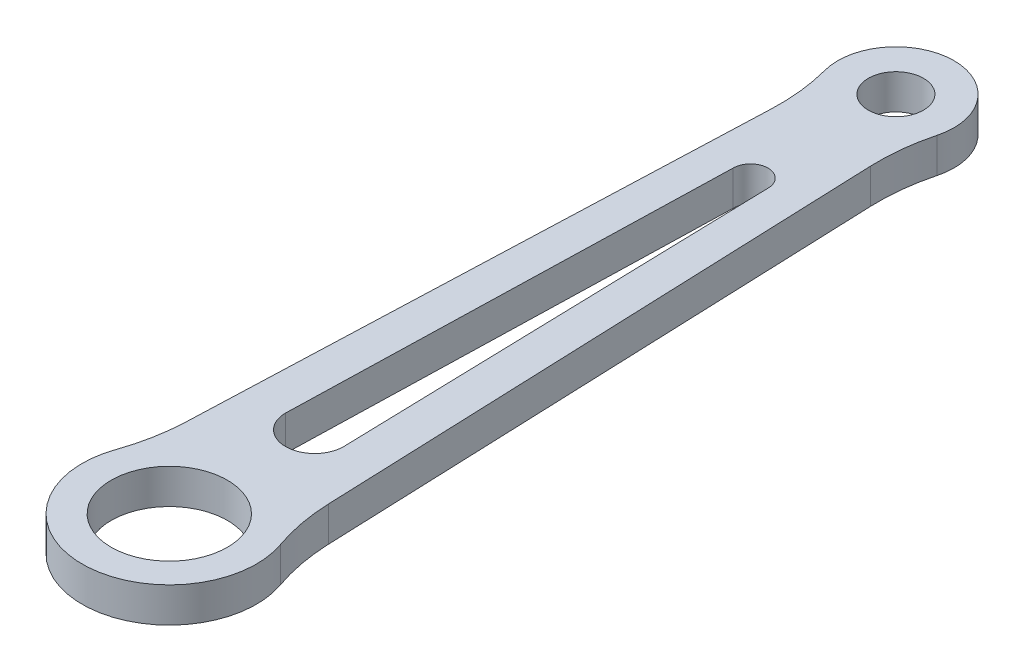
from build123d import *

# Parameters (mm, degrees)
SKETCH_1_R          = 5.05
SKETCH_1_R_2        = 9.5
EXTRUDE_1_DEPTH     = 12
FILLET_1_R          = 3
SKETCH_7_R          = 2.05
CUT_EXTRUDE_4_DEPTH = 277.39464539
EXTRUDE_6_DEPTH     = 12
SKETCH_8_R          = 13
CUT_EXTRUDE_5_DEPTH = 277.39464539
SKETCH_9_R          = 25
SKETCH_9_R_2        = 13
EXTRUDE_4_DEPTH     = 12
SKETCH_10_R         = 1.5
SKETCH_10_R_2       = 21.5
EXTRUDE_5_DEPTH     = 12
SKETCH_13_R         = 1.5
SKETCH_13_R_2       = 19.999997197
SKETCH_13_R_3       = 13
CUT_EXTRUDE_6_DEPTH = 25


with BuildPart() as part:
    # 草图1 → 凸台-拉伸1 (new body)
    with BuildSketch(Plane(origin=(0, 0, 0), x_dir=(1, 0, 0), z_dir=(0, 1, 0))):
        with BuildLine():
            Line((-17.992942616, -0.504), (-24.990198078, 249.3))
            ThreePointArc((-24.990198078, 249.3), (0, 275), (24.990198078, 249.3))
            Line((24.990198078, 249.3), (17.992942616, -0.504))
            ThreePointArc((17.992942616, -0.504), (0, -18), (-17.992942616, -0.504))
        make_face()
        with Locations(Location((0, 0, 0), (0, 0, 270))):
            Circle(SKETCH_1_R, mode=Mode.SUBTRACT)
        with Locations(Location((0, 250, 0), (0, 0, 270))):
            Circle(SKETCH_1_R_2, mode=Mode.SUBTRACT)
        Polygon((-16.444447487, 158.5), (-17.704941698, 203.5), (11.028871219, 137.174942267), align=None, mode=Mode.SUBTRACT)
        Polygon((15.954255294, 141), (18.475243716, 231), (-12, 219.5), align=None, mode=Mode.SUBTRACT)
    extrude(amount=EXTRUDE_1_DEPTH)

    # 圆角1
    fillet_1_edges = [part.edges().sort_by_distance(p)[0] for p in [
        (-16.444447487, 6, -158.5),
        (11.028871219, 6, -137.174942267),
        (-17.704941698, 6, -203.5),
        (18.475243716, 6, -231),
        (-12, 6, -219.5),
        (15.954255294, 6, -141),
    ]]
    fillet(fillet_1_edges, radius=FILLET_1_R)

    # 草图7 → 切除-拉伸4 (cut, through all)
    with BuildSketch(Plane(origin=(0, 12, 0), x_dir=(1, 0, 0), z_dir=(0, 1, 0))):
        with Locations(Location((15, 15, 0), (0, 0, 270))):
            Circle(SKETCH_7_R)
        with Locations(Location((-15, 15, 0), (0, 0, 270))):
            Circle(SKETCH_7_R)
        with Locations((-15, -15)):
            Circle(SKETCH_7_R)
        with Locations((15, -15)):
            Circle(SKETCH_7_R)
    extrude(amount=-CUT_EXTRUDE_4_DEPTH, mode=Mode.SUBTRACT)

    # 草图14 → 凸台-拉伸6 (add)
    with BuildSketch(Plane(origin=(0, 12, 0), x_dir=(1, 0, 0), z_dir=(0, 1, 0))):
        Polygon((-17.958821841, 235.186562879), (21.367198419, 232.917754018), (15.538653821, 131.889647666), (-22.497275836, 156.52002696), align=None)
    extrude(amount=-EXTRUDE_6_DEPTH)

    # 草图8 → 切除-拉伸5 (cut, through all)
    with BuildSketch(Plane(origin=(0, 12, 0), x_dir=(1, 0, 0), z_dir=(0, 1, 0))):
        with Locations(Location((0, 0, 0), (0, 0, 270))):
            Circle(SKETCH_8_R)
    extrude(amount=-CUT_EXTRUDE_5_DEPTH, mode=Mode.SUBTRACT)

    # 草图9 → 凸台-拉伸4 (add)
    with BuildSketch(Plane(origin=(0, 12, 0), x_dir=(1, 0, 0), z_dir=(0, 1, 0))):
        Circle(SKETCH_9_R)
        with Locations(Location((0, 0, 0), (0, 0, 270))):
            Circle(SKETCH_9_R_2, mode=Mode.SUBTRACT)
    extrude(amount=-EXTRUDE_4_DEPTH)

    # 草图10 → 凸台-拉伸5 (add)
    with BuildSketch(Plane(origin=(0, 12, 0), x_dir=(1, 0, 0), z_dir=(0, 1, 0))):
        with BuildLine():
            Line((-39.711049207, 4.799226071), (-40, 0))
            ThreePointArc((-40, 0), (0, -40), (40, 0))
            Line((40, 0), (39.711049207, 4.799226071))
            Line((39.711049207, 4.799226071), (24.990198078, 249.3))
            Line((24.990198078, 249.3), (18.993134598, 35.203136766))
            ThreePointArc((18.993134598, 35.203136766), (0, 40), (-18.993134598, 35.203136766))
            Line((-18.993134598, 35.203136766), (-24.990198078, 249.3))
            Line((-24.990198078, 249.3), (-39.711049207, 4.799226071))
        make_face()
        with Locations(Location((-31.493406412, -20.357194124, 0), (0, 0, 270))):
            Circle(SKETCH_10_R, mode=Mode.SUBTRACT)
        with Locations(Location((-37.210701127, 4.649055992, 0), (0, 0, 270))):
            Circle(SKETCH_10_R, mode=Mode.SUBTRACT)
        with Locations(Location((-11.039996826, -35.838086864, 0), (0, 0, 270))):
            Circle(SKETCH_10_R, mode=Mode.SUBTRACT)
        with Locations((-1.883144055, 37.452687066)):
            Circle(SKETCH_10_R, mode=Mode.SUBTRACT)
        with Locations(Location((14.579149971, -34.549940465, 0), (0, 0, 270))):
            Circle(SKETCH_10_R, mode=Mode.SUBTRACT)
        Circle(SKETCH_10_R_2, mode=Mode.SUBTRACT)
        with Locations(Location((33.376550467, -17.095492942, 0), (0, 0, 270))):
            Circle(SKETCH_10_R, mode=Mode.SUBTRACT)
        with Locations(Location((36.55669206, 8.358125723, 0), (0, 0, 270))):
            Circle(SKETCH_10_R, mode=Mode.SUBTRACT)
    extrude(amount=-EXTRUDE_5_DEPTH)

    # 草图13 → 切除-拉伸6 (cut)
    # profile 1 of 3: a face of its own
    with BuildSketch(Plane(origin=(0, 12, 0), x_dir=(1, 0, 0), z_dir=(0, 1, 0))):
        with BuildLine():
            ThreePointArc((-40, 0), (0, -40), (40, 0))
            Line((40, 0), (24.990198078, 249.3))
            ThreePointArc((24.990198078, 249.3), (0, 275), (-24.990198078, 249.3))
            Line((-24.990198078, 249.3), (-40, 0))
        make_face()
        with Locations((-31.493406412, -20.357194124)):
            Circle(SKETCH_13_R, mode=Mode.SUBTRACT)
        with Locations((-37.210701127, 4.649055992)):
            Circle(SKETCH_13_R, mode=Mode.SUBTRACT)
        with Locations((-11.039996826, -35.838086864)):
            Circle(SKETCH_13_R, mode=Mode.SUBTRACT)
        with Locations((14.579149971, -34.549940465)):
            Circle(SKETCH_13_R, mode=Mode.SUBTRACT)
        with Locations((33.376550467, -17.095492942)):
            Circle(SKETCH_13_R, mode=Mode.SUBTRACT)
        with Locations((36.55669206, 8.358125723)):
            Circle(SKETCH_13_R, mode=Mode.SUBTRACT)
        with BuildLine():
            ThreePointArc((-28.327815251, 9.875975047), (-25.64448638, 19.916210003), (-24.477251587, 30.243074713))
            Line((-24.477251587, 30.243074713), (-17.051673854, 224.281506908))
            ThreePointArc((-17.051673854, 224.281506908), (-17.426051547, 234.665479827), (-19.333438467, 244.879633115))
            ThreePointArc((-19.333438467, 244.879633115), (0, 270), (19.333438467, 244.879633115))
            ThreePointArc((19.333438467, 244.879633115), (17.426051547, 234.665479827), (17.051673854, 224.281506908))
            Line((17.051673854, 224.281506908), (24.477251587, 30.243074713))
            ThreePointArc((24.477251587, 30.243074713), (25.64448638, 19.916210003), (28.327815251, 9.875975047))
            ThreePointArc((28.327815251, 9.875975047), (0, -30), (-28.327815251, 9.875975047))
        make_face(mode=Mode.SUBTRACT)
    # profile 2 of 3: a face of its own
    with BuildSketch(Plane(origin=(0, 12, 0), x_dir=(1, 0, 0), z_dir=(0, 1, 0))):
        with BuildLine():
            ThreePointArc((6, 200), (0, 206), (-6, 200))
            Line((-6, 200), (-10, 50))
            ThreePointArc((-10, 50), (0, 40), (10, 50))
            Line((10, 50), (6, 200))
        make_face()
    # profile 3 of 3: a face of its own
    with BuildSketch(Plane(origin=(0, 12, 0), x_dir=(1, 0, 0), z_dir=(0, 1, 0))):
        with Locations(Location((0, 0, 0), (0, 0, 270))):
            Circle(SKETCH_13_R_2)
        Circle(SKETCH_13_R_3, mode=Mode.SUBTRACT)
    extrude(amount=-CUT_EXTRUDE_6_DEPTH, mode=Mode.SUBTRACT)


solid = part.part
